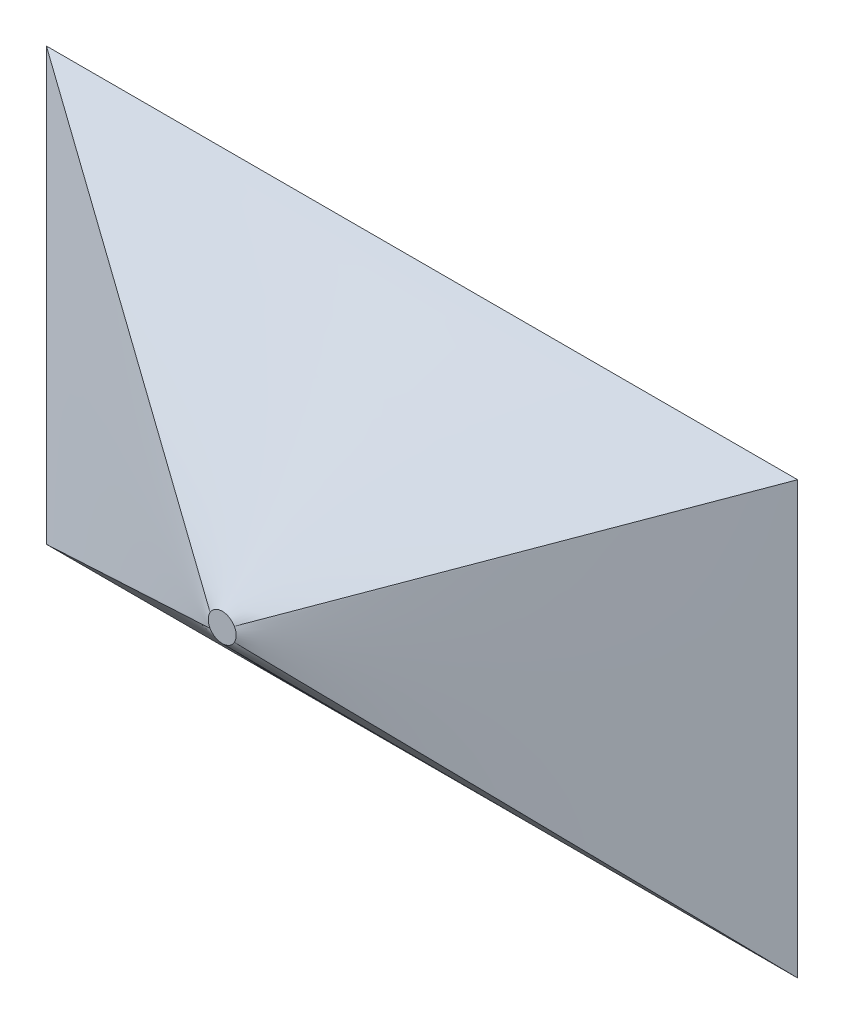
from build123d import *


with BuildPart() as part:
    # Croquis2 for Recubrir2 → Recubrir2 section 0
    with BuildSketch(Plane.XY.offset(100)):
        with BuildLine():
            # circular arc as an exact rational Bezier (weights 1, cos(half-angle), 1)
            Bezier((-6.069738797, 3.486871224), (0, 14.052712834), (6.069738797, 3.486871224), weights=[1, 0.498124461, 1])
            Bezier((6.069738797, 3.486871224), (8.072835033, 0), (6.069738797, -3.486871224), weights=[1, 0.867105542, 1])
            Bezier((6.069738797, -3.486871224), (0, -14.052712834), (-6.069738797, -3.486871224), weights=[1, 0.498124461, 1])
            Bezier((-6.069738797, -3.486871224), (-8.072835033, 0), (-6.069738797, 3.486871224), weights=[1, 0.867105542, 1])
        make_face()
    # Croquis1 → Recubrir2 section 1
    with BuildSketch(Plane.XY):
        with BuildLine():
            Line((-188, 108), (188, 108))
            Line((188, 108), (188, -108))
            Line((188, -108), (-188, -108))
            Line((-188, -108), (-188, 108))
        make_face()
    loft()


solid = part.part
